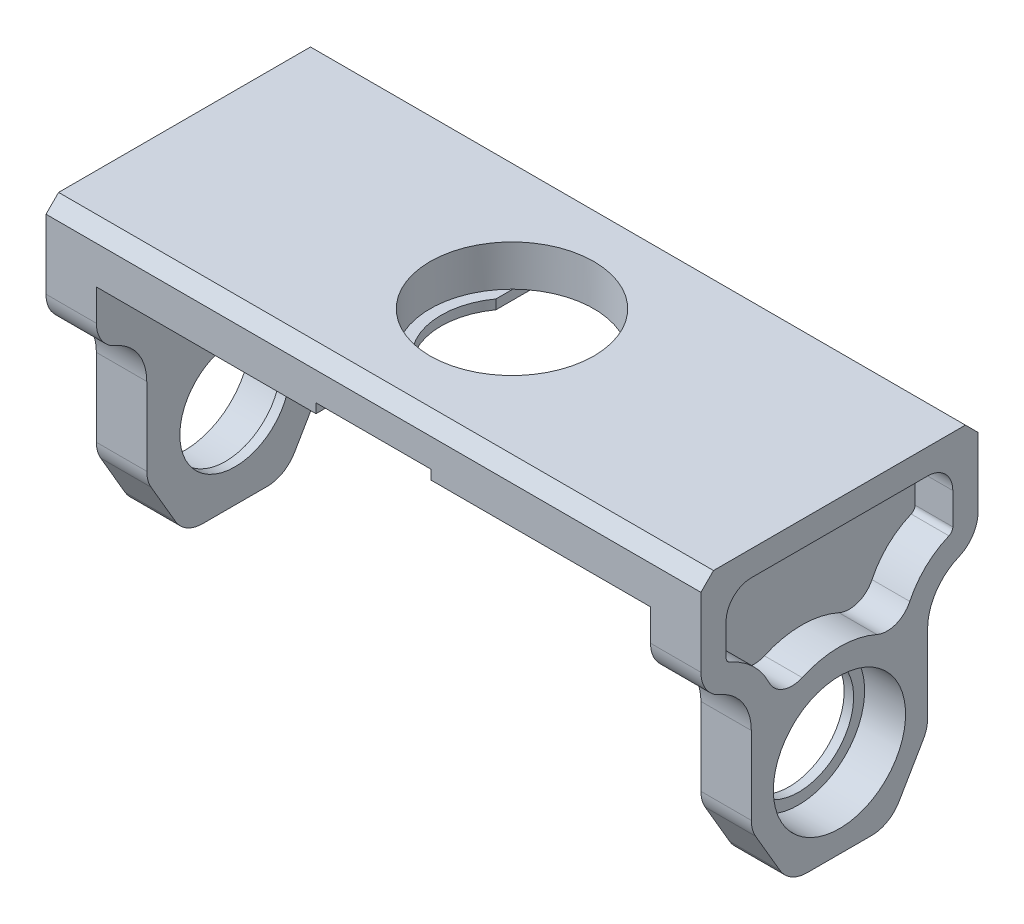
from build123d import *

# Parameters (mm, degrees)
BOSS_EXTRUDE1_DEPTH        = 44
F_21_0_21_DIAMETER_HOLE1_D = 21
F_26_0_26_DIAMETER_HOLE1_D = 26
BOSS_EXTRUDE2_START        = -1.5
SKETCH9_R                  = 10.5
SKETCH9_R_2                = 8.75
BOSS_EXTRUDE2_DEPTH        = 1.5
BOSS_EXTRUDE3_START        = 88
SKETCH9_2_R                = 10.5
SKETCH9_2_R_2              = 8.75
BOSS_EXTRUDE3_DEPTH        = 1.5
SKETCH16_R                 = 13
SKETCH16_R_2               = 11.25
BOSS_EXTRUDE4_DEPTH        = 1.5
SKETCH17_W                 = 18.25
SKETCH17_H                 = 1.5
CUT_EXTRUDE1_DEPTH         = 80.504716841
CUT_EXTRUDE3_DEPTH         = 121.137421314
FILLET3_R                  = 5
RIB1_REACH                 = 71.778
SKETCH20_WALL_W            = 152.870148694
SKETCH20_WALL_H            = 20
RIB2_REACH                 = 71.778
SKETCH21_WALL_W            = 152.870148694
SKETCH21_WALL_H            = 20
SKETCH22_W                 = 20
SKETCH22_H                 = 38
CUT_EXTRUDE4_DEPTH         = 6
CUT_EXTRUDE5_DEPTH         = 121.137421314
CUT_EXTRUDE5_DEPTH_BACK    = 6
CUT_EXTRUDE6_START         = -104
CUT_EXTRUDE6_DEPTH         = 6
FILLET4_R                  = 4
CHAMFER1_SIZE              = 2


with BuildPart() as part:
    # Sketch1 → Boss-Extrude1 (new body)
    with BuildSketch(Plane.XY):
        Polygon((44, 0), (-44, 0), (-44, -41), (-52, -41), (-52, 8), (52, 8), (52, -41), (44, -41), align=None)
    extrude(amount=BOSS_EXTRUDE1_DEPTH)

    # Ø21.0 (21) Diameter Hole1 (through all)
    with Locations(Plane.ZY.offset(52)):
        with Locations((22, -27)):
            Hole(F_21_0_21_DIAMETER_HOLE1_D / 2)

    # Ø26.0 (26) Diameter Hole1 (through all)
    with Locations(Plane(origin=(0, 8, 0), x_dir=(1, 0, 0), z_dir=(0, 1, 0))):
        with Locations((0, -22)):
            Hole(F_26_0_26_DIAMETER_HOLE1_D / 2)

    # Sketch9 → Boss-Extrude2 (add)
    with BuildSketch(Plane.ZY.offset(-44).offset(BOSS_EXTRUDE2_START)):
        with Locations((22, -27)):
            Circle(SKETCH9_R)
        with Locations((22, -27)):
            Circle(SKETCH9_R_2, mode=Mode.SUBTRACT)
    extrude(amount=BOSS_EXTRUDE2_DEPTH)

    # Sketch9<2> → Boss-Extrude3 (add)
    with BuildSketch(Plane.ZY.offset(-44).offset(BOSS_EXTRUDE3_START)):
        with Locations((22, -27)):
            Circle(SKETCH9_2_R)
        with Locations((22, -27)):
            Circle(SKETCH9_2_R_2, mode=Mode.SUBTRACT)
    extrude(amount=BOSS_EXTRUDE3_DEPTH)

    # Sketch16 → Boss-Extrude4 (add)
    with BuildSketch(Plane(origin=(0, 0, 0), x_dir=(1, 0, 0), z_dir=(0, 1, 0))):
        with Locations(Location((0, -22, 0), (0, 0, 270))):
            Circle(SKETCH16_R)
        with Locations(Location((0, -22, 0), (0, 0, 270))):
            Circle(SKETCH16_R_2, mode=Mode.SUBTRACT)
    extrude(amount=BOSS_EXTRUDE4_DEPTH)

    # Sketch17 → Cut-Extrude1 (cut, through all)
    with BuildSketch(Plane.XY.offset(44)):
        with Locations((0, 0.75)):
            Rectangle(SKETCH17_W, SKETCH17_H)
    extrude(amount=-CUT_EXTRUDE1_DEPTH, mode=Mode.SUBTRACT)

    # Sketch19 → Cut-Extrude3 (cut, through all)
    with BuildSketch(Plane.ZY.offset(52)):
        with BuildLine():
            ThreePointArc((0, -25), (2.087839834, -24.722753708), (4.030968204, -23.910231207))
            Line((4.030968204, -23.910231207), (0, -17))
            Line((0, -17), (0, -25))
        make_face()
        with BuildLine():
            Line((0, -17), (4.030968204, -23.910231207))
            ThreePointArc((4.030968204, -23.910231207), (6.937137221, -20.984485812), (8, -17))
            ThreePointArc((8, -17), (5.656854249, -11.343145751), (0, -9))
            Line((0, -9), (0, -17))
        make_face()
        with BuildLine():
            Line((14, -41), (8, -30.714285714))
            Line((8, -30.714285714), (4.030968204, -23.910231207))
            ThreePointArc((4.030968204, -23.910231207), (2.087839834, -24.722753708), (0, -25))
            Line((0, -25), (0, -41))
            Line((0, -41), (14, -41))
        make_face()
        with BuildLine():
            Line((4.030968204, -23.910231207), (8, -30.714285714))
            Line((8, -30.714285714), (8, -17))
            ThreePointArc((8, -17), (6.937137221, -20.984485812), (4.030968204, -23.910231207))
        make_face()
        with BuildLine():
            Line((36, -17), (36, -30.714285714))
            Line((36, -30.714285714), (39.969031796, -23.910231207))
            ThreePointArc((39.969031796, -23.910231207), (37.062862779, -20.984485812), (36, -17))
        make_face()
        with BuildLine():
            ThreePointArc((39.969031796, -23.910231207), (41.912160166, -24.722753708), (44, -25))
            Line((44, -25), (44, -17))
            Line((44, -17), (39.969031796, -23.910231207))
        make_face()
        with BuildLine():
            ThreePointArc((44, -9), (38.343145751, -11.343145751), (36, -17))
            ThreePointArc((36, -17), (37.062862779, -20.984485812), (39.969031796, -23.910231207))
            Line((39.969031796, -23.910231207), (44, -17))
            Line((44, -17), (44, -9))
        make_face()
        with BuildLine():
            Line((36, -30.714285714), (30, -41))
            Line((30, -41), (44, -41))
            Line((44, -41), (44, -25))
            ThreePointArc((44, -25), (41.912160166, -24.722753708), (39.969031796, -23.910231207))
            Line((39.969031796, -23.910231207), (36, -30.714285714))
        make_face()
    extrude(amount=-CUT_EXTRUDE3_DEPTH, mode=Mode.SUBTRACT)

    # Fillet3
    fillet3_edges = [part.edges().sort_by_distance(p)[0] for p in [
        (48, -9, 0),
        (-48, -9, 0),
        (-48, -9, 44),
        (48, -9, 44),
        (-48, -30.714285714, 36),
        (48, -30.714285714, 36),
        (-48, -41, 30),
        (48, -41, 30),
        (-48, -30.714285714, 8),
        (48, -30.714285714, 8),
        (-48, -41, 14),
        (48, -41, 14),
    ]]
    fillet(fillet3_edges, radius=FILLET3_R)

    # Sketch20 wall → Rib1 (add, up to next)
    with BuildSketch(Plane(origin=(-40, -4, 22), x_dir=(-0.707106781187, -0.707106781187, 0), z_dir=(0.707106781187, -0.707106781187, 0)), mode=Mode.PRIVATE) as rib1_sk1:
        Rectangle(SKETCH20_WALL_W, SKETCH20_WALL_H)
    rib1_tool1 = extrude(rib1_sk1.sketch, amount=-RIB1_REACH, mode=Mode.PRIVATE) - part.part
    add(rib1_tool1.solids().sort_by_distance((-40, -4, 22))[0])

    # Sketch21 wall → Rib2 (add, up to next)
    with BuildSketch(Plane(origin=(40, -4, 22), x_dir=(0.707106781187, -0.707106781187, 0), z_dir=(0.707106781187, 0.707106781187, 0)), mode=Mode.PRIVATE) as rib2_sk1:
        Rectangle(SKETCH21_WALL_W, SKETCH21_WALL_H)
    rib2_tool1 = extrude(rib2_sk1.sketch, amount=RIB2_REACH, mode=Mode.PRIVATE) - part.part
    add(rib2_tool1.solids().sort_by_distance((40, -4, 22))[0])

    # Sketch22 → Cut-Extrude4 (cut)
    with BuildSketch(Plane.XZ):
        with Locations((-26, 22)):
            Rectangle(SKETCH22_W, SKETCH22_H)
        with Locations((26, 22)):
            Rectangle(SKETCH22_W, SKETCH22_H)
    extrude(amount=-CUT_EXTRUDE4_DEPTH, mode=Mode.SUBTRACT)

    # Sketch23 → Cut-Extrude5 (cut, two sides: drawn at the far end of the back side and taken through both)
    with BuildSketch(Plane.ZY.offset(52).offset(-CUT_EXTRUDE5_DEPTH_BACK)):
        with BuildLine():
            Line((40, -5), (40, 4))
            Line((40, 4), (4, 4))
            Line((4, 4), (4, -5))
            ThreePointArc((4, -5), (4.167949706, -5.554700196), (4.615384615, -5.923076923))
            ThreePointArc((4.615384615, -5.923076923), (9.846465163, -10.140909405), (11.989973592, -16.509558097))
            ThreePointArc((11.989973592, -16.509558097), (22, -12.5), (32.010026408, -16.509558097))
            ThreePointArc((32.010026408, -16.509558097), (34.153534837, -10.140909405), (39.384615385, -5.923076923))
            ThreePointArc((39.384615385, -5.923076923), (39.832050294, -5.554700196), (40, -5))
        make_face()
    extrude(amount=CUT_EXTRUDE5_DEPTH + CUT_EXTRUDE5_DEPTH_BACK, mode=Mode.SUBTRACT)

    # Sketch23<3> → Cut-Extrude6 (cut)
    with BuildSketch(Plane.ZY.offset(52).offset(CUT_EXTRUDE6_START)):
        with BuildLine():
            Line((40, -5), (40, 4))
            Line((40, 4), (4, 4))
            Line((4, 4), (4, -5))
            ThreePointArc((4, -5), (4.167949706, -5.554700196), (4.615384615, -5.923076923))
            ThreePointArc((4.615384615, -5.923076923), (9.846465163, -10.140909405), (11.989973592, -16.509558097))
            ThreePointArc((11.989973592, -16.509558097), (22, -12.5), (32.010026408, -16.509558097))
            ThreePointArc((32.010026408, -16.509558097), (34.153534837, -10.140909405), (39.384615385, -5.923076923))
            ThreePointArc((39.384615385, -5.923076923), (39.832050294, -5.554700196), (40, -5))
        make_face()
    extrude(amount=CUT_EXTRUDE6_DEPTH, mode=Mode.SUBTRACT)

    # Fillet4
    fillet4_edges = [part.edges().sort_by_distance(p)[0] for p in [
        (-49, -16.509558097, 11.989973592),
        (-49, -16.509558097, 32.010026408),
        (49, -16.509558097, 32.010026408),
        (49, -16.509558097, 11.989973592),
        (49, 4, 4),
        (49, 4, 40),
        (-49, 4, 40),
        (-49, 4, 4),
        (36, 3, 3),
        (-16, 3, 3),
        (36, 3, 41),
        (-16, 3, 41),
        (-36, 3, 3),
        (16, 3, 3),
        (16, 3, 41),
        (-36, 3, 41),
    ]]
    fillet(fillet4_edges, radius=FILLET4_R)

    # Chamfer1
    chamfer1_edges = [part.edges().sort_by_distance(p)[0] for p in [
        (0, 8, 44),
        (0, 8, 0),
    ]]
    chamfer(chamfer1_edges, length=CHAMFER1_SIZE)


solid = part.part
